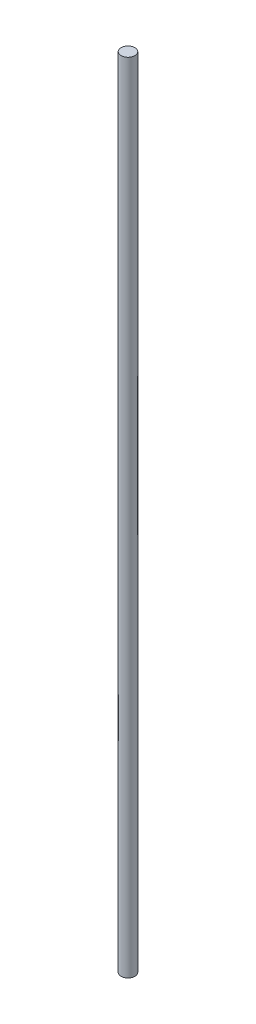
from build123d import *

# Parameters (mm, degrees)
SKETCH_1_R      = 3.96875
EXTRUDE_1_DEPTH = 457.2


with BuildPart() as part:
    # 草图1 → 凸台-拉伸1 (new body)
    with BuildSketch(Plane(origin=(0, 0, 0), x_dir=(1, 0, 0), z_dir=(0, 1, 0))):
        with Locations(Location((0, 0, 0), (0, 0, 270))):
            Circle(SKETCH_1_R)
    extrude(amount=EXTRUDE_1_DEPTH)


solid = part.part
